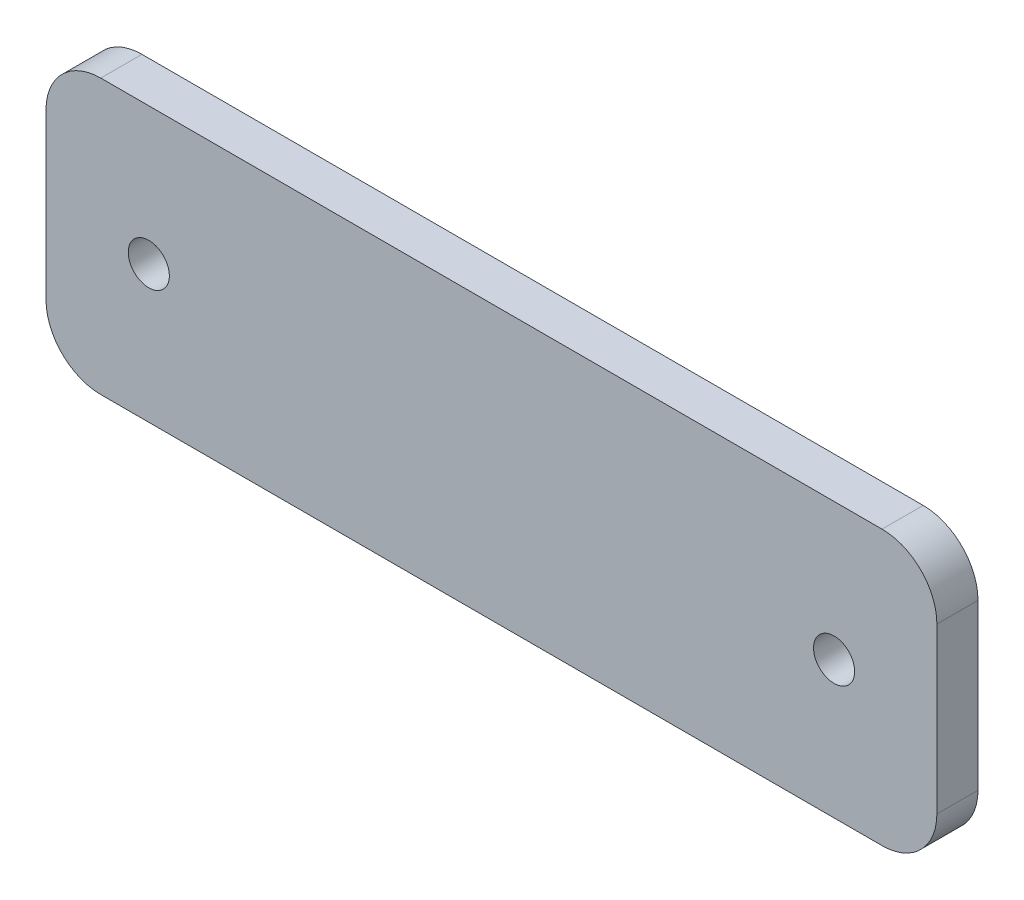
from build123d import *

# Parameters (mm, degrees)
SKETCH_1_W          = 65
SKETCH_1_H          = 20
EXTRUDE_1_DEPTH     = 3
SKETCH_2_R          = 1.5
CUT_EXTRUDE_1_DEPTH = 3
FILLET_1_R          = 4


with BuildPart() as part:
    # 草图1 → 凸台-拉伸1 (new body)
    with BuildSketch(Plane.XY):
        Rectangle(SKETCH_1_W, SKETCH_1_H)
    extrude(amount=EXTRUDE_1_DEPTH)

    # 草图2 → 切除-拉伸1 (cut)
    with BuildSketch(Plane.XY.offset(3)):
        with Locations((25, 0)):
            Circle(SKETCH_2_R)
        with Locations((-25, 0)):
            Circle(SKETCH_2_R)
    extrude(amount=-CUT_EXTRUDE_1_DEPTH, mode=Mode.SUBTRACT)

    # 圆角1
    fillet_1_edges = [part.edges().sort_by_distance(p)[0] for p in [
        (-32.5, 10, 1.5),
        (32.5, 10, 1.5),
        (32.5, -10, 1.5),
        (-32.5, -10, 1.5),
    ]]
    fillet(fillet_1_edges, radius=FILLET_1_R)


solid = part.part
